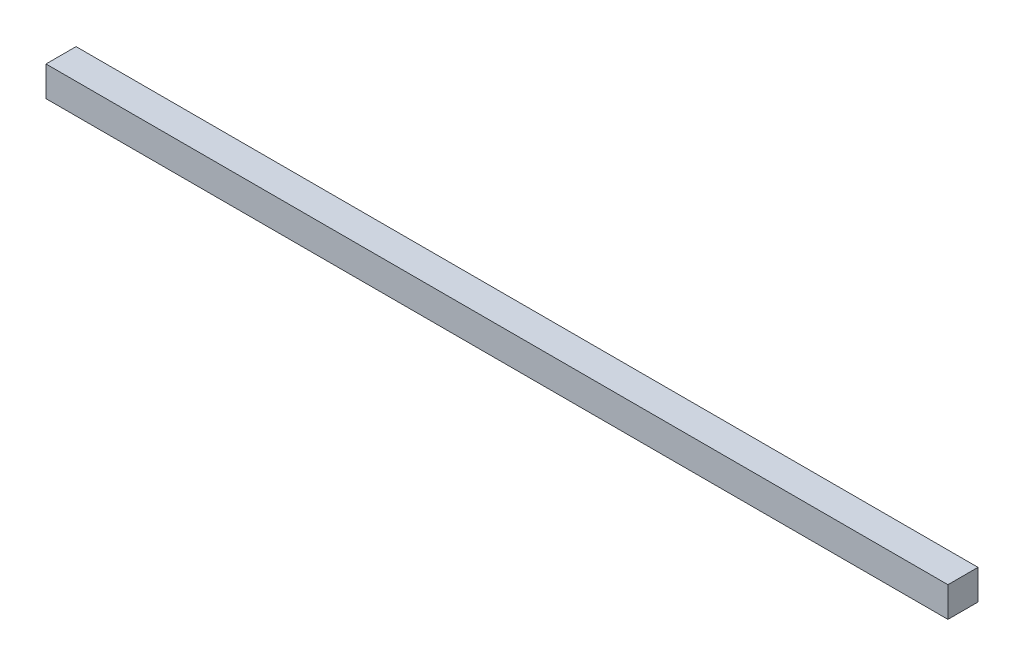
from build123d import *

# Parameters (mm, degrees)
SKETCH1_W           = 381
SKETCH1_H           = 12.7
BOSS_EXTRUDE1_DEPTH = 12.7


with BuildPart() as part:
    # Sketch1 → Boss-Extrude1 (new body)
    with BuildSketch(Plane.XY):
        with Locations((-11.505226481, 6.35)):
            Rectangle(SKETCH1_W, SKETCH1_H)
    extrude(amount=BOSS_EXTRUDE1_DEPTH)


solid = part.part
